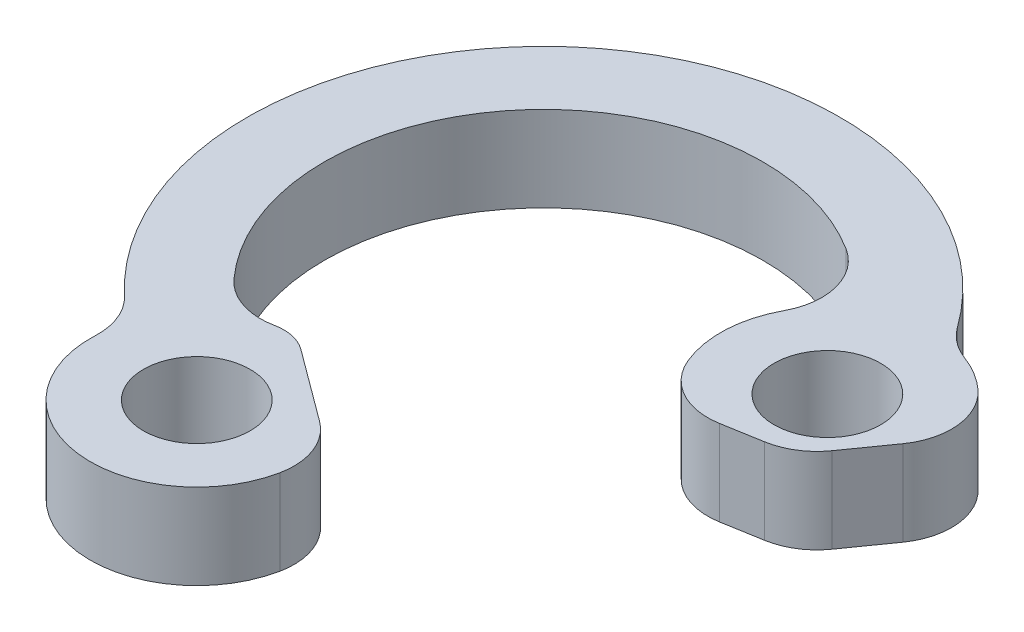
from build123d import *

# Parameters (mm, degrees)
SKETCH2_R           = 2.5
BOSS_EXTRUDE1_DEPTH = 4
FILLET1_R           = 3
CUT_EXTRUDE2_DEPTH  = 7
FILLET2_R           = 3
FILLET3_R           = 2
CUT_EXTRUDE3_DEPTH  = 4
FILLET4_R           = 3
CUT_EXTRUDE4_DEPTH  = 5
FILLET5_R           = 3


with BuildPart() as part:
    # Sketch2 → Boss-Extrude1 (new body)
    with BuildSketch(Plane(origin=(0, 0, 0), x_dir=(1, 0, 0), z_dir=(0, 1, 0))):
        with BuildLine():
            ThreePointArc((70.082441242, 70.375471459), (68.701032678, 85.785425288), (84.157953122, 85.10824213))
            ThreePointArc((84.157953122, 85.10824213), (88.169530247, 76.167900978), (87.971523368, 85.965004847))
            ThreePointArc((87.971523368, 85.965004847), (66.773130519, 88.957801307), (67.785886209, 67.573156911))
            ThreePointArc((67.785886209, 67.573156911), (76.405902982, 62.851068524), (70.082441242, 70.375471459))
        make_face()
        with Locations(Location((72.538655529, 66.020358214, 0), (0, 0, 270))):
            Circle(SKETCH2_R, mode=Mode.SUBTRACT)
        with Locations(Location((87.073540725, 81.04630307, 0), (0, 0, 270))):
            Circle(SKETCH2_R, mode=Mode.SUBTRACT)
    extrude(amount=BOSS_EXTRUDE1_DEPTH)

    # Fillet1
    fillet1_edges = [part.edges().sort_by_distance(p)[0] for p in [
        (84.157953122, 2, -85.10824213),
        (70.082441242, 2, -70.375471459),
        (67.785886209, 2, -67.573156911),
        (87.971523368, 2, -85.965004847),
    ]]
    fillet(fillet1_edges, radius=FILLET1_R)

    # Sketch4 → Cut-Extrude2 (cut)
    with BuildSketch(Plane(origin=(0, 0, 0), x_dir=(-1, 0, 0), z_dir=(0, -1, 0))):
        Polygon((-78.063653069, 66.716653157), (-72.1449642, 71.091471725), (-73.077184563, 72.352671977), (-78.995873431, 67.977853409), align=None)
    extrude(amount=-CUT_EXTRUDE2_DEPTH, mode=Mode.SUBTRACT)

    # Fillet2
    fillet2_edges = [part.edges().sort_by_distance(p)[0] for p in [
        (77.394817884, 2, -67.211024909),
    ]]
    fillet(fillet2_edges, radius=FILLET2_R)

    # Fillet3
    fillet3_edges = [part.edges().sort_by_distance(p)[0] for p in [
        (72.252278132, 2, -71.012150275),
    ]]
    fillet(fillet3_edges, radius=FILLET3_R)

    # Sketch5 → Cut-Extrude3 (cut)
    with BuildSketch(Plane(origin=(0, 4, 0), x_dir=(1, 0, 0), z_dir=(0, 1, 0))):
        Polygon((91.915683274, 82.292760262), (87.509474915, 76.065343184), (89.248604191, 74.615528375), (94.045863103, 81.084803637), align=None)
    extrude(amount=-CUT_EXTRUDE3_DEPTH, mode=Mode.SUBTRACT)

    # Fillet4
    fillet4_edges = [part.edges().sort_by_distance(p)[0] for p in [
        (91.915683274, 2, -82.292760262),
        (87.509474915, 2, -76.065343184),
    ]]
    fillet(fillet4_edges, radius=FILLET4_R)

    # Sketch6 → Cut-Extrude4 (cut)
    with BuildSketch(Plane(origin=(0, 4, 0), x_dir=(1, 0, 0), z_dir=(0, 1, 0))):
        Polygon((88.770033289, 77.846925466), (84.083019815, 77.039211271), (84.659332186, 75.34612768), (89.090596179, 75.986759337), align=None)
    extrude(amount=-CUT_EXTRUDE4_DEPTH, mode=Mode.SUBTRACT)

    # Fillet5
    fillet5_edges = [part.edges().sort_by_distance(p)[0] for p in [
        (88.770033289, 2, -77.846925466),
        (84.083019815, 2, -77.039211271),
    ]]
    fillet(fillet5_edges, radius=FILLET5_R)


solid = part.part
